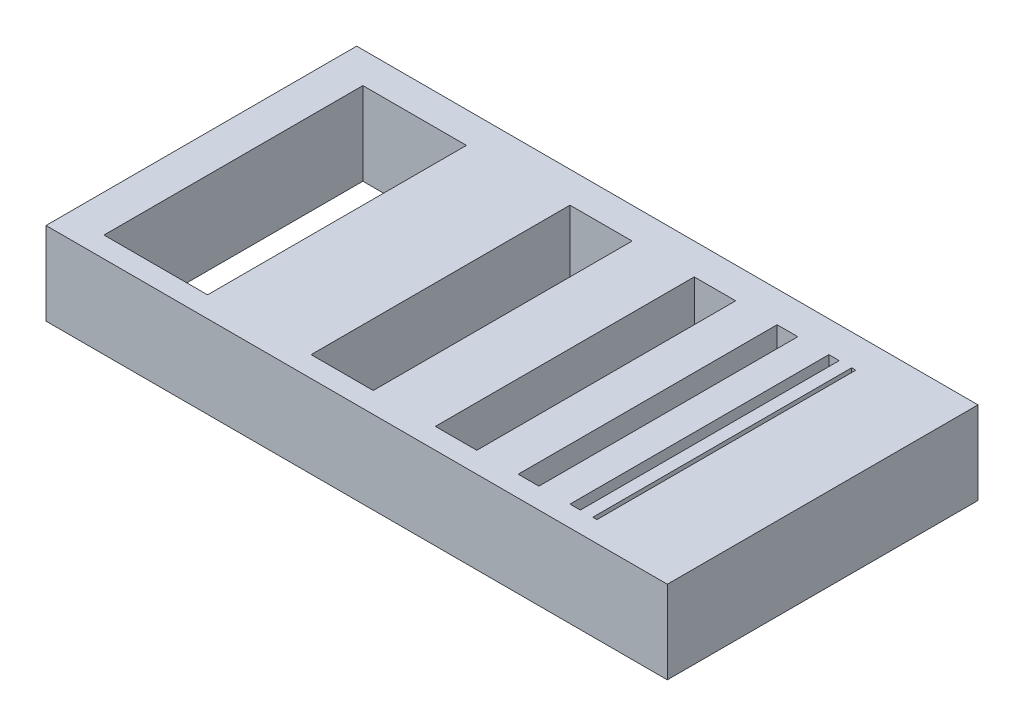
from build123d import *

# Parameters (mm, degrees)
SKETCH2_W           = 150
SKETCH2_H           = 75
SKETCH2_W_2         = 25
SKETCH2_H_2         = 62.5
SKETCH2_W_3         = 15
SKETCH2_W_4         = 10
SKETCH2_W_5         = 5
SKETCH2_W_6         = 2.5
SKETCH2_W_7         = 1
BOSS_EXTRUDE1_DEPTH = 20


with BuildPart() as part:
    # Sketch2 → Boss-Extrude1 (new body)
    with BuildSketch(Plane(origin=(0, 0, 0), x_dir=(1, 0, 0), z_dir=(0, 1, 0))):
        with Locations((75, 37.5)):
            Rectangle(SKETCH2_W, SKETCH2_H)
        with Locations((21.5, 36.25)):
            Rectangle(SKETCH2_W_2, SKETCH2_H_2, mode=Mode.SUBTRACT)
        with Locations((66.5, 36.25)):
            Rectangle(SKETCH2_W_3, SKETCH2_H_2, mode=Mode.SUBTRACT)
        with Locations((94, 36.25)):
            Rectangle(SKETCH2_W_4, SKETCH2_H_2, mode=Mode.SUBTRACT)
        with Locations((111.5, 36.25)):
            Rectangle(SKETCH2_W_5, SKETCH2_H_2, mode=Mode.SUBTRACT)
        with Locations((122.75, 36.25)):
            Rectangle(SKETCH2_W_6, SKETCH2_H_2, mode=Mode.SUBTRACT)
        with Locations((127.5, 36.25)):
            Rectangle(SKETCH2_W_7, SKETCH2_H_2, mode=Mode.SUBTRACT)
    extrude(amount=BOSS_EXTRUDE1_DEPTH)


solid = part.part
